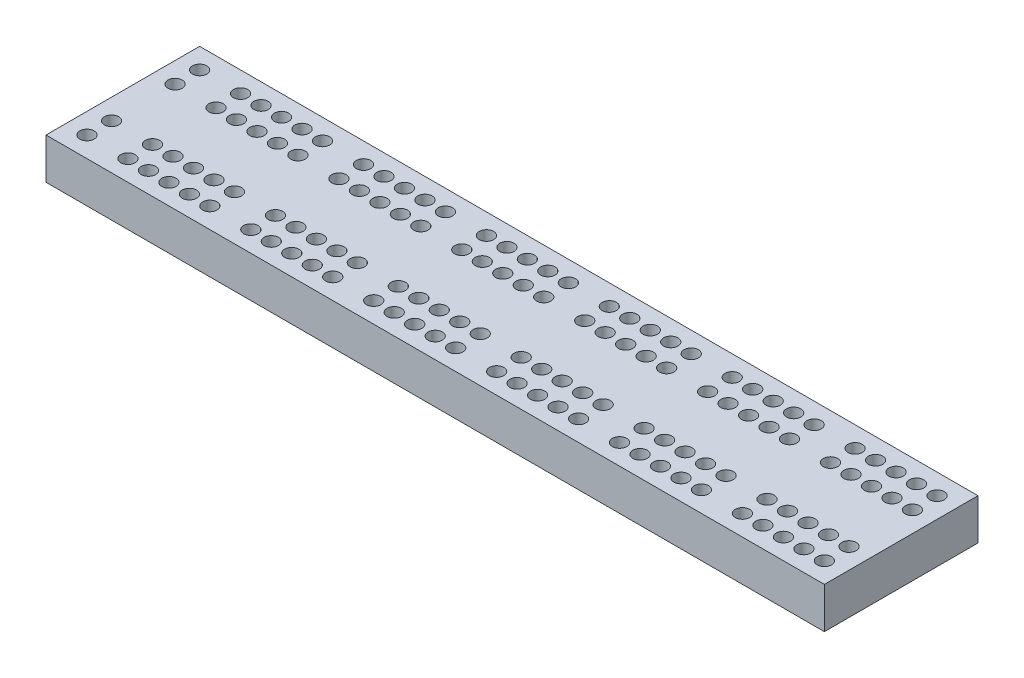
from build123d import *

# Parameters (mm, degrees)
SKETCH_1_W                  = 380
SKETCH_1_H                  = 20
EXTRUDE_1_DEPTH             = 37.5
PATTERN_LINEAR_1_COUNT      = 37
PATTERN_LINEAR_1_PITCH      = 10
PATTERN_LINEAR_1_COUNT_DIR2 = 2
PATTERN_LINEAR_1_PITCH_DIR2 = 12


with BuildPart() as part:
    # 草圖1 → 填料-伸長1 (new, symmetric)
    with BuildSketch(Plane.XY):
        with Locations((190, 0)):
            Rectangle(SKETCH_1_W, SKETCH_1_H)
    extrude(amount=EXTRUDE_1_DEPTH, both=True)

    # 草圖3 → Ø7.0 (7) 直徑孔1 (revolve, cut)
    with BuildSketch(Plane(origin=(10, 10, -27.5), x_dir=(0, 0, 1), z_dir=(1, 0, 0))):
        Polygon((0, 0), (0, 14.103012167), (3.5, 12), (3.5, 0), align=None)
    hole_wizard_7_0_7_1 = revolve(axis=Axis((10, 16.35, -27.5), (0, -1, 0)), mode=Mode.SUBTRACT)

    # 直線複製排列1: Hole Wizard 7.0 _7_ _1 37 × 2, 12 skipped
    with Locations(*[(i * PATTERN_LINEAR_1_PITCH, 0, j * PATTERN_LINEAR_1_PITCH_DIR2) for i in range(PATTERN_LINEAR_1_COUNT) for j in range(PATTERN_LINEAR_1_COUNT_DIR2) if (i, j) not in ((0, 0), (1, 0), (1, 1), (7, 0), (7, 1), (13, 0), (13, 1), (19, 0), (19, 1), (25, 0), (25, 1), (31, 0), (31, 1))]):
        add(hole_wizard_7_0_7_1, mode=Mode.SUBTRACT)

    # 鏡射1: Ø7.0 (7) 直徑孔1 across plane
    add(hole_wizard_7_0_7_1.mirror(Plane.XY), mode=Mode.SUBTRACT)

    # 鏡射1 copy 1 sketch → 鏡射1 copy 1 (revolve, cut)
    with BuildSketch(Plane(origin=(10, 10, 15.5), x_dir=(0, 0, -1), z_dir=(1, 0, 0))):
        Polygon((0, 0), (0, -14.103012167), (3.5, -12), (3.5, 0), align=None)
    revolve(axis=Axis((10, 16.35, 15.5), (0, 1, 0)), mode=Mode.SUBTRACT)

    # 鏡射1 copy 2 sketch → 鏡射1 copy 2 (revolve, cut)
    with BuildSketch(Plane(origin=(30, 10, 27.5), x_dir=(0, 0, -1), z_dir=(1, 0, 0))):
        Polygon((0, 0), (0, -14.103012167), (3.5, -12), (3.5, 0), align=None)
    revolve(axis=Axis((30, 16.35, 27.5), (0, 1, 0)), mode=Mode.SUBTRACT)

    # 鏡射1 copy 3 sketch → 鏡射1 copy 3 (revolve, cut)
    with BuildSketch(Plane(origin=(30, 10, 15.5), x_dir=(0, 0, -1), z_dir=(1, 0, 0))):
        Polygon((0, 0), (0, -14.103012167), (3.5, -12), (3.5, 0), align=None)
    revolve(axis=Axis((30, 16.35, 15.5), (0, 1, 0)), mode=Mode.SUBTRACT)

    # 鏡射1 copy 4 sketch → 鏡射1 copy 4 (revolve, cut)
    with BuildSketch(Plane(origin=(40, 10, 27.5), x_dir=(0, 0, -1), z_dir=(1, 0, 0))):
        Polygon((0, 0), (0, -14.103012167), (3.5, -12), (3.5, 0), align=None)
    revolve(axis=Axis((40, 16.35, 27.5), (0, 1, 0)), mode=Mode.SUBTRACT)

    # 鏡射1 copy 5 sketch → 鏡射1 copy 5 (revolve, cut)
    with BuildSketch(Plane(origin=(40, 10, 15.5), x_dir=(0, 0, -1), z_dir=(1, 0, 0))):
        Polygon((0, 0), (0, -14.103012167), (3.5, -12), (3.5, 0), align=None)
    revolve(axis=Axis((40, 16.35, 15.5), (0, 1, 0)), mode=Mode.SUBTRACT)

    # 鏡射1 copy 6 sketch → 鏡射1 copy 6 (revolve, cut)
    with BuildSketch(Plane(origin=(50, 10, 27.5), x_dir=(0, 0, -1), z_dir=(1, 0, 0))):
        Polygon((0, 0), (0, -14.103012167), (3.5, -12), (3.5, 0), align=None)
    revolve(axis=Axis((50, 16.35, 27.5), (0, 1, 0)), mode=Mode.SUBTRACT)

    # 鏡射1 copy 7 sketch → 鏡射1 copy 7 (revolve, cut)
    with BuildSketch(Plane(origin=(50, 10, 15.5), x_dir=(0, 0, -1), z_dir=(1, 0, 0))):
        Polygon((0, 0), (0, -14.103012167), (3.5, -12), (3.5, 0), align=None)
    revolve(axis=Axis((50, 16.35, 15.5), (0, 1, 0)), mode=Mode.SUBTRACT)

    # 鏡射1 copy 8 sketch → 鏡射1 copy 8 (revolve, cut)
    with BuildSketch(Plane(origin=(60, 10, 27.5), x_dir=(0, 0, -1), z_dir=(1, 0, 0))):
        Polygon((0, 0), (0, -14.103012167), (3.5, -12), (3.5, 0), align=None)
    revolve(axis=Axis((60, 16.35, 27.5), (0, 1, 0)), mode=Mode.SUBTRACT)

    # 鏡射1 copy 9 sketch → 鏡射1 copy 9 (revolve, cut)
    with BuildSketch(Plane(origin=(60, 10, 15.5), x_dir=(0, 0, -1), z_dir=(1, 0, 0))):
        Polygon((0, 0), (0, -14.103012167), (3.5, -12), (3.5, 0), align=None)
    revolve(axis=Axis((60, 16.35, 15.5), (0, 1, 0)), mode=Mode.SUBTRACT)

    # 鏡射1 copy 10 sketch → 鏡射1 copy 10 (revolve, cut)
    with BuildSketch(Plane(origin=(70, 10, 27.5), x_dir=(0, 0, -1), z_dir=(1, 0, 0))):
        Polygon((0, 0), (0, -14.103012167), (3.5, -12), (3.5, 0), align=None)
    revolve(axis=Axis((70, 16.35, 27.5), (0, 1, 0)), mode=Mode.SUBTRACT)

    # 鏡射1 copy 11 sketch → 鏡射1 copy 11 (revolve, cut)
    with BuildSketch(Plane(origin=(70, 10, 15.5), x_dir=(0, 0, -1), z_dir=(1, 0, 0))):
        Polygon((0, 0), (0, -14.103012167), (3.5, -12), (3.5, 0), align=None)
    revolve(axis=Axis((70, 16.35, 15.5), (0, 1, 0)), mode=Mode.SUBTRACT)

    # 鏡射1 copy 12 sketch → 鏡射1 copy 12 (revolve, cut)
    with BuildSketch(Plane(origin=(90, 10, 27.5), x_dir=(0, 0, -1), z_dir=(1, 0, 0))):
        Polygon((0, 0), (0, -14.103012167), (3.5, -12), (3.5, 0), align=None)
    revolve(axis=Axis((90, 16.35, 27.5), (0, 1, 0)), mode=Mode.SUBTRACT)

    # 鏡射1 copy 13 sketch → 鏡射1 copy 13 (revolve, cut)
    with BuildSketch(Plane(origin=(90, 10, 15.5), x_dir=(0, 0, -1), z_dir=(1, 0, 0))):
        Polygon((0, 0), (0, -14.103012167), (3.5, -12), (3.5, 0), align=None)
    revolve(axis=Axis((90, 16.35, 15.5), (0, 1, 0)), mode=Mode.SUBTRACT)

    # 鏡射1 copy 14 sketch → 鏡射1 copy 14 (revolve, cut)
    with BuildSketch(Plane(origin=(100, 10, 27.5), x_dir=(0, 0, -1), z_dir=(1, 0, 0))):
        Polygon((0, 0), (0, -14.103012167), (3.5, -12), (3.5, 0), align=None)
    revolve(axis=Axis((100, 16.35, 27.5), (0, 1, 0)), mode=Mode.SUBTRACT)

    # 鏡射1 copy 15 sketch → 鏡射1 copy 15 (revolve, cut)
    with BuildSketch(Plane(origin=(100, 10, 15.5), x_dir=(0, 0, -1), z_dir=(1, 0, 0))):
        Polygon((0, 0), (0, -14.103012167), (3.5, -12), (3.5, 0), align=None)
    revolve(axis=Axis((100, 16.35, 15.5), (0, 1, 0)), mode=Mode.SUBTRACT)

    # 鏡射1 copy 16 sketch → 鏡射1 copy 16 (revolve, cut)
    with BuildSketch(Plane(origin=(110, 10, 27.5), x_dir=(0, 0, -1), z_dir=(1, 0, 0))):
        Polygon((0, 0), (0, -14.103012167), (3.5, -12), (3.5, 0), align=None)
    revolve(axis=Axis((110, 16.35, 27.5), (0, 1, 0)), mode=Mode.SUBTRACT)

    # 鏡射1 copy 17 sketch → 鏡射1 copy 17 (revolve, cut)
    with BuildSketch(Plane(origin=(110, 10, 15.5), x_dir=(0, 0, -1), z_dir=(1, 0, 0))):
        Polygon((0, 0), (0, -14.103012167), (3.5, -12), (3.5, 0), align=None)
    revolve(axis=Axis((110, 16.35, 15.5), (0, 1, 0)), mode=Mode.SUBTRACT)

    # 鏡射1 copy 18 sketch → 鏡射1 copy 18 (revolve, cut)
    with BuildSketch(Plane(origin=(120, 10, 27.5), x_dir=(0, 0, -1), z_dir=(1, 0, 0))):
        Polygon((0, 0), (0, -14.103012167), (3.5, -12), (3.5, 0), align=None)
    revolve(axis=Axis((120, 16.35, 27.5), (0, 1, 0)), mode=Mode.SUBTRACT)

    # 鏡射1 copy 19 sketch → 鏡射1 copy 19 (revolve, cut)
    with BuildSketch(Plane(origin=(120, 10, 15.5), x_dir=(0, 0, -1), z_dir=(1, 0, 0))):
        Polygon((0, 0), (0, -14.103012167), (3.5, -12), (3.5, 0), align=None)
    revolve(axis=Axis((120, 16.35, 15.5), (0, 1, 0)), mode=Mode.SUBTRACT)

    # 鏡射1 copy 20 sketch → 鏡射1 copy 20 (revolve, cut)
    with BuildSketch(Plane(origin=(130, 10, 27.5), x_dir=(0, 0, -1), z_dir=(1, 0, 0))):
        Polygon((0, 0), (0, -14.103012167), (3.5, -12), (3.5, 0), align=None)
    revolve(axis=Axis((130, 16.35, 27.5), (0, 1, 0)), mode=Mode.SUBTRACT)

    # 鏡射1 copy 21 sketch → 鏡射1 copy 21 (revolve, cut)
    with BuildSketch(Plane(origin=(130, 10, 15.5), x_dir=(0, 0, -1), z_dir=(1, 0, 0))):
        Polygon((0, 0), (0, -14.103012167), (3.5, -12), (3.5, 0), align=None)
    revolve(axis=Axis((130, 16.35, 15.5), (0, 1, 0)), mode=Mode.SUBTRACT)

    # 鏡射1 copy 22 sketch → 鏡射1 copy 22 (revolve, cut)
    with BuildSketch(Plane(origin=(150, 10, 27.5), x_dir=(0, 0, -1), z_dir=(1, 0, 0))):
        Polygon((0, 0), (0, -14.103012167), (3.5, -12), (3.5, 0), align=None)
    revolve(axis=Axis((150, 16.35, 27.5), (0, 1, 0)), mode=Mode.SUBTRACT)

    # 鏡射1 copy 23 sketch → 鏡射1 copy 23 (revolve, cut)
    with BuildSketch(Plane(origin=(150, 10, 15.5), x_dir=(0, 0, -1), z_dir=(1, 0, 0))):
        Polygon((0, 0), (0, -14.103012167), (3.5, -12), (3.5, 0), align=None)
    revolve(axis=Axis((150, 16.35, 15.5), (0, 1, 0)), mode=Mode.SUBTRACT)

    # 鏡射1 copy 24 sketch → 鏡射1 copy 24 (revolve, cut)
    with BuildSketch(Plane(origin=(160, 10, 27.5), x_dir=(0, 0, -1), z_dir=(1, 0, 0))):
        Polygon((0, 0), (0, -14.103012167), (3.5, -12), (3.5, 0), align=None)
    revolve(axis=Axis((160, 16.35, 27.5), (0, 1, 0)), mode=Mode.SUBTRACT)

    # 鏡射1 copy 25 sketch → 鏡射1 copy 25 (revolve, cut)
    with BuildSketch(Plane(origin=(160, 10, 15.5), x_dir=(0, 0, -1), z_dir=(1, 0, 0))):
        Polygon((0, 0), (0, -14.103012167), (3.5, -12), (3.5, 0), align=None)
    revolve(axis=Axis((160, 16.35, 15.5), (0, 1, 0)), mode=Mode.SUBTRACT)

    # 鏡射1 copy 26 sketch → 鏡射1 copy 26 (revolve, cut)
    with BuildSketch(Plane(origin=(170, 10, 27.5), x_dir=(0, 0, -1), z_dir=(1, 0, 0))):
        Polygon((0, 0), (0, -14.103012167), (3.5, -12), (3.5, 0), align=None)
    revolve(axis=Axis((170, 16.35, 27.5), (0, 1, 0)), mode=Mode.SUBTRACT)

    # 鏡射1 copy 27 sketch → 鏡射1 copy 27 (revolve, cut)
    with BuildSketch(Plane(origin=(170, 10, 15.5), x_dir=(0, 0, -1), z_dir=(1, 0, 0))):
        Polygon((0, 0), (0, -14.103012167), (3.5, -12), (3.5, 0), align=None)
    revolve(axis=Axis((170, 16.35, 15.5), (0, 1, 0)), mode=Mode.SUBTRACT)

    # 鏡射1 copy 28 sketch → 鏡射1 copy 28 (revolve, cut)
    with BuildSketch(Plane(origin=(180, 10, 27.5), x_dir=(0, 0, -1), z_dir=(1, 0, 0))):
        Polygon((0, 0), (0, -14.103012167), (3.5, -12), (3.5, 0), align=None)
    revolve(axis=Axis((180, 16.35, 27.5), (0, 1, 0)), mode=Mode.SUBTRACT)

    # 鏡射1 copy 29 sketch → 鏡射1 copy 29 (revolve, cut)
    with BuildSketch(Plane(origin=(180, 10, 15.5), x_dir=(0, 0, -1), z_dir=(1, 0, 0))):
        Polygon((0, 0), (0, -14.103012167), (3.5, -12), (3.5, 0), align=None)
    revolve(axis=Axis((180, 16.35, 15.5), (0, 1, 0)), mode=Mode.SUBTRACT)

    # 鏡射1 copy 30 sketch → 鏡射1 copy 30 (revolve, cut)
    with BuildSketch(Plane(origin=(190, 10, 27.5), x_dir=(0, 0, -1), z_dir=(1, 0, 0))):
        Polygon((0, 0), (0, -14.103012167), (3.5, -12), (3.5, 0), align=None)
    revolve(axis=Axis((190, 16.35, 27.5), (0, 1, 0)), mode=Mode.SUBTRACT)

    # 鏡射1 copy 31 sketch → 鏡射1 copy 31 (revolve, cut)
    with BuildSketch(Plane(origin=(190, 10, 15.5), x_dir=(0, 0, -1), z_dir=(1, 0, 0))):
        Polygon((0, 0), (0, -14.103012167), (3.5, -12), (3.5, 0), align=None)
    revolve(axis=Axis((190, 16.35, 15.5), (0, 1, 0)), mode=Mode.SUBTRACT)

    # 鏡射1 copy 32 sketch → 鏡射1 copy 32 (revolve, cut)
    with BuildSketch(Plane(origin=(210, 10, 27.5), x_dir=(0, 0, -1), z_dir=(1, 0, 0))):
        Polygon((0, 0), (0, -14.103012167), (3.5, -12), (3.5, 0), align=None)
    revolve(axis=Axis((210, 16.35, 27.5), (0, 1, 0)), mode=Mode.SUBTRACT)

    # 鏡射1 copy 33 sketch → 鏡射1 copy 33 (revolve, cut)
    with BuildSketch(Plane(origin=(210, 10, 15.5), x_dir=(0, 0, -1), z_dir=(1, 0, 0))):
        Polygon((0, 0), (0, -14.103012167), (3.5, -12), (3.5, 0), align=None)
    revolve(axis=Axis((210, 16.35, 15.5), (0, 1, 0)), mode=Mode.SUBTRACT)

    # 鏡射1 copy 34 sketch → 鏡射1 copy 34 (revolve, cut)
    with BuildSketch(Plane(origin=(220, 10, 27.5), x_dir=(0, 0, -1), z_dir=(1, 0, 0))):
        Polygon((0, 0), (0, -14.103012167), (3.5, -12), (3.5, 0), align=None)
    revolve(axis=Axis((220, 16.35, 27.5), (0, 1, 0)), mode=Mode.SUBTRACT)

    # 鏡射1 copy 35 sketch → 鏡射1 copy 35 (revolve, cut)
    with BuildSketch(Plane(origin=(220, 10, 15.5), x_dir=(0, 0, -1), z_dir=(1, 0, 0))):
        Polygon((0, 0), (0, -14.103012167), (3.5, -12), (3.5, 0), align=None)
    revolve(axis=Axis((220, 16.35, 15.5), (0, 1, 0)), mode=Mode.SUBTRACT)

    # 鏡射1 copy 36 sketch → 鏡射1 copy 36 (revolve, cut)
    with BuildSketch(Plane(origin=(230, 10, 27.5), x_dir=(0, 0, -1), z_dir=(1, 0, 0))):
        Polygon((0, 0), (0, -14.103012167), (3.5, -12), (3.5, 0), align=None)
    revolve(axis=Axis((230, 16.35, 27.5), (0, 1, 0)), mode=Mode.SUBTRACT)

    # 鏡射1 copy 37 sketch → 鏡射1 copy 37 (revolve, cut)
    with BuildSketch(Plane(origin=(230, 10, 15.5), x_dir=(0, 0, -1), z_dir=(1, 0, 0))):
        Polygon((0, 0), (0, -14.103012167), (3.5, -12), (3.5, 0), align=None)
    revolve(axis=Axis((230, 16.35, 15.5), (0, 1, 0)), mode=Mode.SUBTRACT)

    # 鏡射1 copy 38 sketch → 鏡射1 copy 38 (revolve, cut)
    with BuildSketch(Plane(origin=(240, 10, 27.5), x_dir=(0, 0, -1), z_dir=(1, 0, 0))):
        Polygon((0, 0), (0, -14.103012167), (3.5, -12), (3.5, 0), align=None)
    revolve(axis=Axis((240, 16.35, 27.5), (0, 1, 0)), mode=Mode.SUBTRACT)

    # 鏡射1 copy 39 sketch → 鏡射1 copy 39 (revolve, cut)
    with BuildSketch(Plane(origin=(240, 10, 15.5), x_dir=(0, 0, -1), z_dir=(1, 0, 0))):
        Polygon((0, 0), (0, -14.103012167), (3.5, -12), (3.5, 0), align=None)
    revolve(axis=Axis((240, 16.35, 15.5), (0, 1, 0)), mode=Mode.SUBTRACT)

    # 鏡射1 copy 40 sketch → 鏡射1 copy 40 (revolve, cut)
    with BuildSketch(Plane(origin=(250, 10, 27.5), x_dir=(0, 0, -1), z_dir=(1, 0, 0))):
        Polygon((0, 0), (0, -14.103012167), (3.5, -12), (3.5, 0), align=None)
    revolve(axis=Axis((250, 16.35, 27.5), (0, 1, 0)), mode=Mode.SUBTRACT)

    # 鏡射1 copy 41 sketch → 鏡射1 copy 41 (revolve, cut)
    with BuildSketch(Plane(origin=(250, 10, 15.5), x_dir=(0, 0, -1), z_dir=(1, 0, 0))):
        Polygon((0, 0), (0, -14.103012167), (3.5, -12), (3.5, 0), align=None)
    revolve(axis=Axis((250, 16.35, 15.5), (0, 1, 0)), mode=Mode.SUBTRACT)

    # 鏡射1 copy 42 sketch → 鏡射1 copy 42 (revolve, cut)
    with BuildSketch(Plane(origin=(270, 10, 27.5), x_dir=(0, 0, -1), z_dir=(1, 0, 0))):
        Polygon((0, 0), (0, -14.103012167), (3.5, -12), (3.5, 0), align=None)
    revolve(axis=Axis((270, 16.35, 27.5), (0, 1, 0)), mode=Mode.SUBTRACT)

    # 鏡射1 copy 43 sketch → 鏡射1 copy 43 (revolve, cut)
    with BuildSketch(Plane(origin=(270, 10, 15.5), x_dir=(0, 0, -1), z_dir=(1, 0, 0))):
        Polygon((0, 0), (0, -14.103012167), (3.5, -12), (3.5, 0), align=None)
    revolve(axis=Axis((270, 16.35, 15.5), (0, 1, 0)), mode=Mode.SUBTRACT)

    # 鏡射1 copy 44 sketch → 鏡射1 copy 44 (revolve, cut)
    with BuildSketch(Plane(origin=(280, 10, 27.5), x_dir=(0, 0, -1), z_dir=(1, 0, 0))):
        Polygon((0, 0), (0, -14.103012167), (3.5, -12), (3.5, 0), align=None)
    revolve(axis=Axis((280, 16.35, 27.5), (0, 1, 0)), mode=Mode.SUBTRACT)

    # 鏡射1 copy 45 sketch → 鏡射1 copy 45 (revolve, cut)
    with BuildSketch(Plane(origin=(280, 10, 15.5), x_dir=(0, 0, -1), z_dir=(1, 0, 0))):
        Polygon((0, 0), (0, -14.103012167), (3.5, -12), (3.5, 0), align=None)
    revolve(axis=Axis((280, 16.35, 15.5), (0, 1, 0)), mode=Mode.SUBTRACT)

    # 鏡射1 copy 46 sketch → 鏡射1 copy 46 (revolve, cut)
    with BuildSketch(Plane(origin=(290, 10, 27.5), x_dir=(0, 0, -1), z_dir=(1, 0, 0))):
        Polygon((0, 0), (0, -14.103012167), (3.5, -12), (3.5, 0), align=None)
    revolve(axis=Axis((290, 16.35, 27.5), (0, 1, 0)), mode=Mode.SUBTRACT)

    # 鏡射1 copy 47 sketch → 鏡射1 copy 47 (revolve, cut)
    with BuildSketch(Plane(origin=(290, 10, 15.5), x_dir=(0, 0, -1), z_dir=(1, 0, 0))):
        Polygon((0, 0), (0, -14.103012167), (3.5, -12), (3.5, 0), align=None)
    revolve(axis=Axis((290, 16.35, 15.5), (0, 1, 0)), mode=Mode.SUBTRACT)

    # 鏡射1 copy 48 sketch → 鏡射1 copy 48 (revolve, cut)
    with BuildSketch(Plane(origin=(300, 10, 27.5), x_dir=(0, 0, -1), z_dir=(1, 0, 0))):
        Polygon((0, 0), (0, -14.103012167), (3.5, -12), (3.5, 0), align=None)
    revolve(axis=Axis((300, 16.35, 27.5), (0, 1, 0)), mode=Mode.SUBTRACT)

    # 鏡射1 copy 49 sketch → 鏡射1 copy 49 (revolve, cut)
    with BuildSketch(Plane(origin=(300, 10, 15.5), x_dir=(0, 0, -1), z_dir=(1, 0, 0))):
        Polygon((0, 0), (0, -14.103012167), (3.5, -12), (3.5, 0), align=None)
    revolve(axis=Axis((300, 16.35, 15.5), (0, 1, 0)), mode=Mode.SUBTRACT)

    # 鏡射1 copy 50 sketch → 鏡射1 copy 50 (revolve, cut)
    with BuildSketch(Plane(origin=(310, 10, 27.5), x_dir=(0, 0, -1), z_dir=(1, 0, 0))):
        Polygon((0, 0), (0, -14.103012167), (3.5, -12), (3.5, 0), align=None)
    revolve(axis=Axis((310, 16.35, 27.5), (0, 1, 0)), mode=Mode.SUBTRACT)

    # 鏡射1 copy 51 sketch → 鏡射1 copy 51 (revolve, cut)
    with BuildSketch(Plane(origin=(310, 10, 15.5), x_dir=(0, 0, -1), z_dir=(1, 0, 0))):
        Polygon((0, 0), (0, -14.103012167), (3.5, -12), (3.5, 0), align=None)
    revolve(axis=Axis((310, 16.35, 15.5), (0, 1, 0)), mode=Mode.SUBTRACT)

    # 鏡射1 copy 52 sketch → 鏡射1 copy 52 (revolve, cut)
    with BuildSketch(Plane(origin=(330, 10, 27.5), x_dir=(0, 0, -1), z_dir=(1, 0, 0))):
        Polygon((0, 0), (0, -14.103012167), (3.5, -12), (3.5, 0), align=None)
    revolve(axis=Axis((330, 16.35, 27.5), (0, 1, 0)), mode=Mode.SUBTRACT)

    # 鏡射1 copy 53 sketch → 鏡射1 copy 53 (revolve, cut)
    with BuildSketch(Plane(origin=(330, 10, 15.5), x_dir=(0, 0, -1), z_dir=(1, 0, 0))):
        Polygon((0, 0), (0, -14.103012167), (3.5, -12), (3.5, 0), align=None)
    revolve(axis=Axis((330, 16.35, 15.5), (0, 1, 0)), mode=Mode.SUBTRACT)

    # 鏡射1 copy 54 sketch → 鏡射1 copy 54 (revolve, cut)
    with BuildSketch(Plane(origin=(340, 10, 27.5), x_dir=(0, 0, -1), z_dir=(1, 0, 0))):
        Polygon((0, 0), (0, -14.103012167), (3.5, -12), (3.5, 0), align=None)
    revolve(axis=Axis((340, 16.35, 27.5), (0, 1, 0)), mode=Mode.SUBTRACT)

    # 鏡射1 copy 55 sketch → 鏡射1 copy 55 (revolve, cut)
    with BuildSketch(Plane(origin=(340, 10, 15.5), x_dir=(0, 0, -1), z_dir=(1, 0, 0))):
        Polygon((0, 0), (0, -14.103012167), (3.5, -12), (3.5, 0), align=None)
    revolve(axis=Axis((340, 16.35, 15.5), (0, 1, 0)), mode=Mode.SUBTRACT)

    # 鏡射1 copy 56 sketch → 鏡射1 copy 56 (revolve, cut)
    with BuildSketch(Plane(origin=(350, 10, 27.5), x_dir=(0, 0, -1), z_dir=(1, 0, 0))):
        Polygon((0, 0), (0, -14.103012167), (3.5, -12), (3.5, 0), align=None)
    revolve(axis=Axis((350, 16.35, 27.5), (0, 1, 0)), mode=Mode.SUBTRACT)

    # 鏡射1 copy 57 sketch → 鏡射1 copy 57 (revolve, cut)
    with BuildSketch(Plane(origin=(350, 10, 15.5), x_dir=(0, 0, -1), z_dir=(1, 0, 0))):
        Polygon((0, 0), (0, -14.103012167), (3.5, -12), (3.5, 0), align=None)
    revolve(axis=Axis((350, 16.35, 15.5), (0, 1, 0)), mode=Mode.SUBTRACT)

    # 鏡射1 copy 58 sketch → 鏡射1 copy 58 (revolve, cut)
    with BuildSketch(Plane(origin=(360, 10, 27.5), x_dir=(0, 0, -1), z_dir=(1, 0, 0))):
        Polygon((0, 0), (0, -14.103012167), (3.5, -12), (3.5, 0), align=None)
    revolve(axis=Axis((360, 16.35, 27.5), (0, 1, 0)), mode=Mode.SUBTRACT)

    # 鏡射1 copy 59 sketch → 鏡射1 copy 59 (revolve, cut)
    with BuildSketch(Plane(origin=(360, 10, 15.5), x_dir=(0, 0, -1), z_dir=(1, 0, 0))):
        Polygon((0, 0), (0, -14.103012167), (3.5, -12), (3.5, 0), align=None)
    revolve(axis=Axis((360, 16.35, 15.5), (0, 1, 0)), mode=Mode.SUBTRACT)

    # 鏡射1 copy 60 sketch → 鏡射1 copy 60 (revolve, cut)
    with BuildSketch(Plane(origin=(370, 10, 27.5), x_dir=(0, 0, -1), z_dir=(1, 0, 0))):
        Polygon((0, 0), (0, -14.103012167), (3.5, -12), (3.5, 0), align=None)
    revolve(axis=Axis((370, 16.35, 27.5), (0, 1, 0)), mode=Mode.SUBTRACT)

    # 鏡射1 copy 61 sketch → 鏡射1 copy 61 (revolve, cut)
    with BuildSketch(Plane(origin=(370, 10, 15.5), x_dir=(0, 0, -1), z_dir=(1, 0, 0))):
        Polygon((0, 0), (0, -14.103012167), (3.5, -12), (3.5, 0), align=None)
    revolve(axis=Axis((370, 16.35, 15.5), (0, 1, 0)), mode=Mode.SUBTRACT)


solid = part.part
